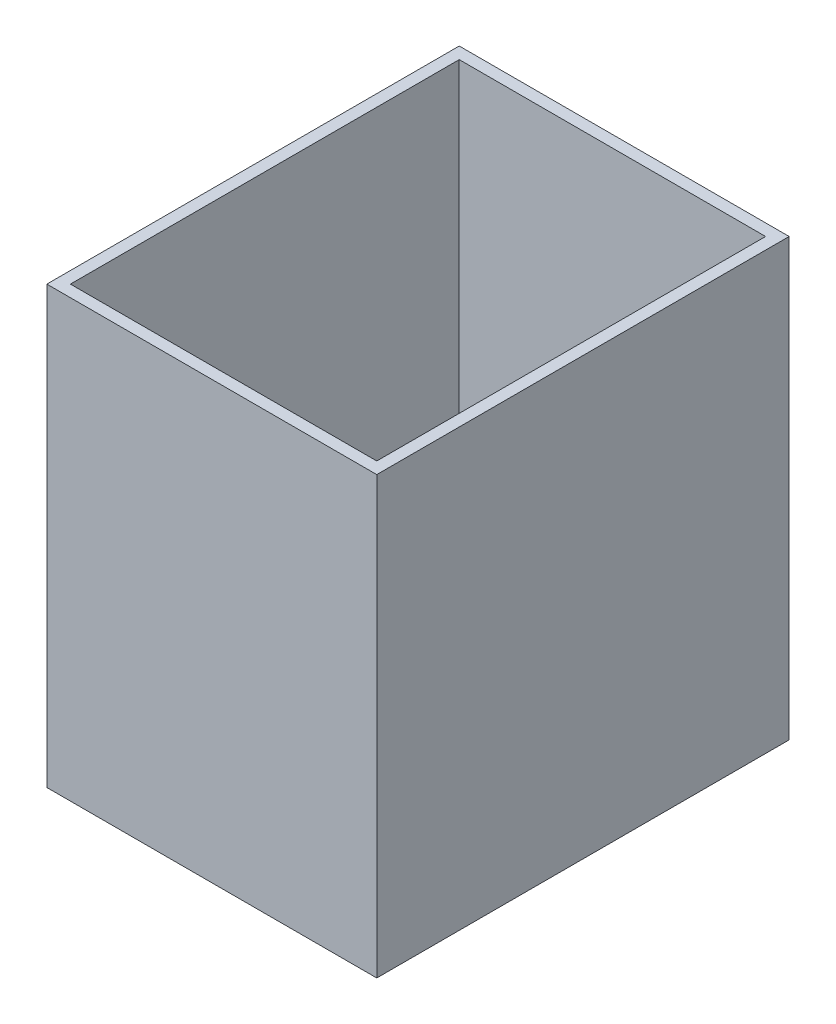
from build123d import *

# Parameters (mm, degrees)
SKETCH_1_W          = 28
SKETCH_1_H          = 35
EXTRUDE_1_DEPTH     = 37
CUT_EXTRUDE_1_DEPTH = 36


with BuildPart() as part:
    # 草圖1 → 填料-伸長1 (new body)
    with BuildSketch(Plane(origin=(0, 0, 0), x_dir=(1, 0, 0), z_dir=(0, 1, 0))):
        with Locations((-20.111315493, -3.900635196)):
            Rectangle(SKETCH_1_W, SKETCH_1_H)
    extrude(amount=EXTRUDE_1_DEPTH)

    # 草圖2 → 除料-伸長1 (cut)
    with BuildSketch(Plane(origin=(0, 37, 0), x_dir=(1, 0, 0), z_dir=(0, 1, 0))):
        Polygon((-33.111315493, -20.400635196), (-7.111315493, -20.400635196), (-7.111315493, 12.599364804), (-33.111315493, 12.599364804), (-33.111315493, -3.900635196), align=None)
    extrude(amount=-CUT_EXTRUDE_1_DEPTH, mode=Mode.SUBTRACT)


solid = part.part
